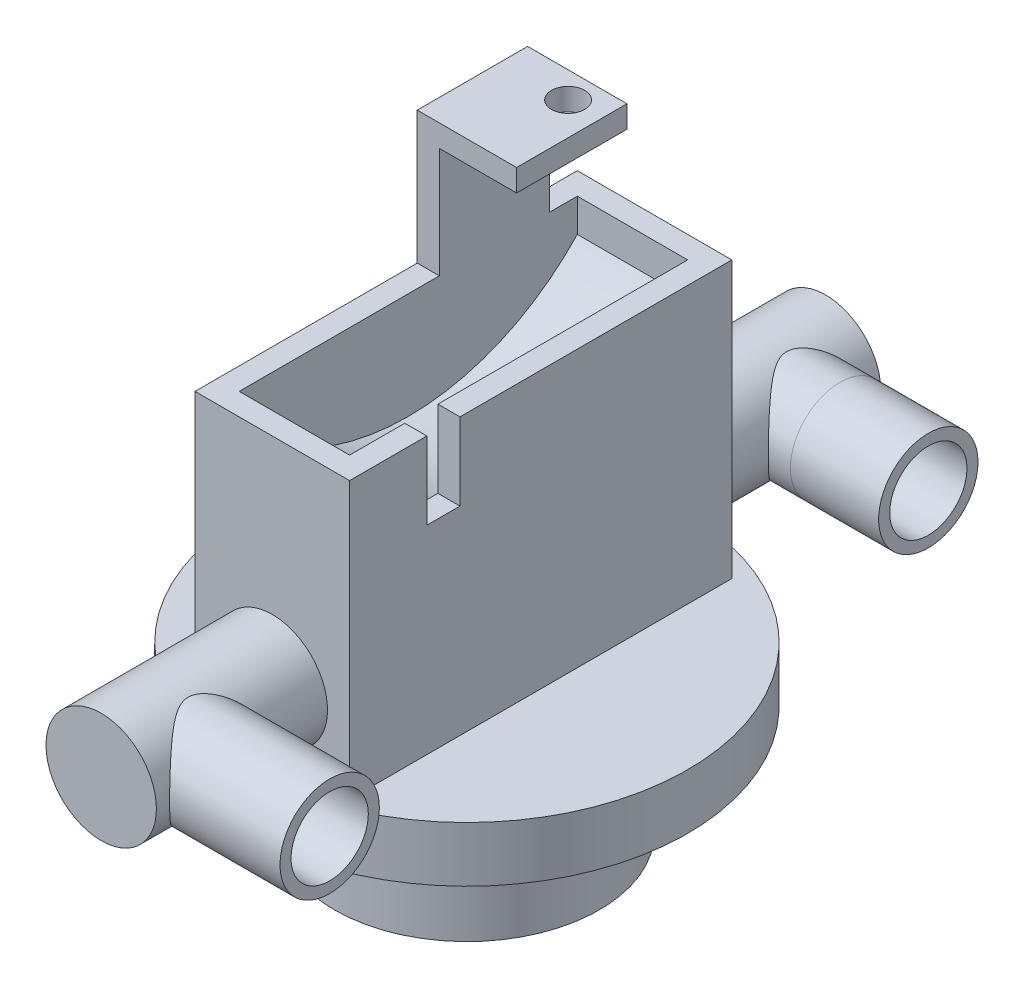
from build123d import *

# Parameters (mm, degrees)
SKETCH_1_R               = 20
EXTRUDE_1_DEPTH          = 5
SKETCH_2_W               = 14
SKETCH_2_H               = 34.630049735
EXTRUDE_2_DEPTH          = 25
SKETCH_3_W               = 10
SKETCH_3_H               = 30.630049735
CUT_EXTRUDE_1_DEPTH      = 3
CUT_EXTRUDE_2_DEPTH      = 10
SKETCH_5_W               = 2
SKETCH_5_H               = 3
CUT_EXTRUDE_3_DEPTH      = 7
SKETCH_6_W               = 2
SKETCH_6_H               = 10
EXTRUDE_3_DEPTH          = 10
EXTRUDE_4_DEPTH          = 2
SKETCH_8_R               = 1.5
CUT_EXTRUDE_4_DEPTH      = 2
SKETCH_9_R               = 4
CUT_EXTRUDE_5_DEPTH      = 35
EXTRUDE_START            = 14.5
SKETCH_10_R              = 5
SKETCH_10_R_2            = 4
EXTRUDE_5_DEPTH          = 14.5
EXTRUDE_6_REACH          = 61.375
EXTRUDE_6_END_RADIUS     = 5
SKETCH_11_R              = 4.5
CUT_EXTRUDE_6_REACH      = 61.375
CUT_EXTRUDE_6_END_RADIUS = 4
SKETCH_12_R              = 3.5
SKETCH_13_R              = 5
EXTRUDE_7_DEPTH          = 1
SKETCH_14_R              = 4.5
SKETCH_14_R_2            = 3.5
EXTRUDE_8_DEPTH          = 8
SKETCH_15_R              = 5
SKETCH_15_R_2            = 3.998003616
EXTRUDE_9_DEPTH          = 14.5
SKETCH_16_R              = 5
EXTRUDE_11_DEPTH         = 1
CUT_EXTRUDE_7_REACH      = 61.922
CUT_EXTRUDE_7_END_RADIUS = 5
SKETCH_17_R              = 3.5
SKETCH_19_R              = 12
EXTRUDE_12_DEPTH         = 10


with BuildPart() as part:
    # Эскиз1 → Бобышка-Вытянуть1 (new body)
    with BuildSketch(Plane(origin=(0, 0, 0), x_dir=(1, 0, 0), z_dir=(0, 1, 0))):
        with Locations(Location((0, 0, 0), (0, 0, 270))):
            Circle(SKETCH_1_R)
    extrude(amount=EXTRUDE_1_DEPTH)

    # Эскиз2 → Бобышка-Вытянуть2 (add)
    with BuildSketch(Plane(origin=(0, 5, 0), x_dir=(1, 0, 0), z_dir=(0, 1, 0))):
        with Locations((0, -0.315024868)):
            Rectangle(SKETCH_2_W, SKETCH_2_H)
    extrude(amount=EXTRUDE_2_DEPTH)

    # Эскиз3 → Вырез-Вытянуть1 (cut)
    with BuildSketch(Plane(origin=(0, 30, 0), x_dir=(1, 0, 0), z_dir=(0, 1, 0))):
        with Locations((0, -0.315024868)):
            Rectangle(SKETCH_3_W, SKETCH_3_H)
    extrude(amount=-CUT_EXTRUDE_1_DEPTH, mode=Mode.SUBTRACT)

    # Эскиз4 → Вырез-Вытянуть2 (cut)
    with BuildSketch(Plane(origin=(-5, 0, 0), x_dir=(0, 0, -1), z_dir=(1, 0, 0))):
        with BuildLine():
            Line((-15.630049735, 27), (15, 27))
            ThreePointArc((15, 27), (-0.315024867, 20.368368499), (-15.630049735, 27))
        make_face()
    extrude(amount=CUT_EXTRUDE_2_DEPTH, mode=Mode.SUBTRACT)

    # Эскиз5 → Вырез-Вытянуть3 (cut)
    with BuildSketch(Plane(origin=(0, 30, 0), x_dir=(1, 0, 0), z_dir=(0, 1, 0))):
        with Locations((6, -9.130049735)):
            Rectangle(SKETCH_5_W, SKETCH_5_H)
    extrude(amount=-CUT_EXTRUDE_3_DEPTH, mode=Mode.SUBTRACT)

    # Эскиз6 → Бобышка-Вытянуть3 (add)
    with BuildSketch(Plane(origin=(0, 30, 0), x_dir=(1, 0, 0), z_dir=(0, 1, 0))):
        with Locations((-6, 7.5)):
            Rectangle(SKETCH_6_W, SKETCH_6_H)
    extrude(amount=EXTRUDE_3_DEPTH)

    # Эскиз7 → Бобышка-Вытянуть4 (add)
    with BuildSketch(Plane(origin=(0, 40, 0), x_dir=(1, 0, 0), z_dir=(0, 1, 0))):
        Polygon((-7, 12.5), (-5, 12.5), (2, 12.5), (2, 2.5), (-5, 2.5), (-7, 2.5), align=None)
    extrude(amount=EXTRUDE_4_DEPTH)

    # Эскиз8 → Вырез-Вытянуть4 (cut)
    with BuildSketch(Plane(origin=(0, 42, 0), x_dir=(1, 0, 0), z_dir=(0, 1, 0))):
        with Locations(Location((-0.97037305, 10.13600386, 0), (0, 0, 270))):
            Circle(SKETCH_8_R)
    extrude(amount=-CUT_EXTRUDE_4_DEPTH, mode=Mode.SUBTRACT)

    # Эскиз9 → Вырез-Вытянуть5 (cut)
    with BuildSketch(Plane.XY.offset(17.630049735)):
        with Locations((0, 11)):
            Circle(SKETCH_9_R)
    extrude(amount=-CUT_EXTRUDE_5_DEPTH, mode=Mode.SUBTRACT)

    # Эскиз10 → Бобышка-Вытянуть5 (add)
    with BuildSketch(Plane.XY.offset(17.630049735).offset(EXTRUDE_START)):
        with Locations(Location((0, 11, 0), (0, 0, 180))):
            Circle(SKETCH_10_R)
        with Locations((0, 11)):
            Circle(SKETCH_10_R_2, mode=Mode.SUBTRACT)
    extrude(amount=-EXTRUDE_5_DEPTH)

    # Бобышка-Вытянуть6: up to this cylinder (the profile starts outside it)
    extrude_6_end = Plane(origin=(0, 11, 0.315025), z_dir=(0, 0, -1)) * Cylinder(EXTRUDE_6_END_RADIUS, 187.98005, mode=Mode.PRIVATE)
    # Эскиз11 → Бобышка-Вытянуть6 (add, up to the surface)
    with BuildSketch(Plane(origin=(7, 0, 0), x_dir=(0, 0, -1), z_dir=(1, 0, 0)), mode=Mode.PRIVATE) as extrude_6_sk1:
        with Locations((-27.430049735, 11)):
            Circle(SKETCH_11_R)
    extrude_6_tool1 = extrude(extrude_6_sk1.sketch, amount=-EXTRUDE_6_REACH, mode=Mode.PRIVATE) - extrude_6_end
    add(extrude_6_tool1.solids().sort_by_distance((7, 11, 27.43005))[0])
    # Эскиз11 → Бобышка-Вытянуть6 (add, up to the surface)
    with BuildSketch(Plane(origin=(7, 0, 0), x_dir=(0, 0, -1), z_dir=(1, 0, 0)), mode=Mode.PRIVATE) as extrude_6_sk2:
        with Locations((26.8, 11)):
            Circle(SKETCH_11_R)
    extrude_6_tool2 = extrude(extrude_6_sk2.sketch, amount=-EXTRUDE_6_REACH, mode=Mode.PRIVATE) - extrude_6_end
    add(extrude_6_tool2.solids().sort_by_distance((7, 11, -26.8))[0])


with BuildPart() as extrude_6_piece_1:
    # of the separate pieces the step leaves, piece 1, a body of its own (extrude_6_pieces)
    add(part.part.solids().sort_by_distance((0, 0, 20))[0])

    # Вырез-Вытянуть6: up to this cylinder (the profile starts outside it)
    cut_extrude_6_end = Plane(origin=(0, 11, 27.43005), z_dir=(0, 0, 1)) * Cylinder(CUT_EXTRUDE_6_END_RADIUS, 131.75, mode=Mode.PRIVATE)
    # Эскиз12 → Вырез-Вытянуть6 (cut, up to the surface)
    with BuildSketch(Plane(origin=(7, 0, 0), x_dir=(0, 0, -1), z_dir=(1, 0, 0)), mode=Mode.PRIVATE) as cut_extrude_6_sk1:
        with Locations((-27.430049735, 11)):
            Circle(SKETCH_12_R)
    cut_extrude_6_tool1 = extrude(cut_extrude_6_sk1.sketch, amount=-CUT_EXTRUDE_6_REACH, mode=Mode.PRIVATE) - cut_extrude_6_end
    add(cut_extrude_6_tool1.solids().sort_by_distance((7, 11, 27.43005))[0], mode=Mode.SUBTRACT)

    # Эскиз13 → Бобышка-Вытянуть7 (add)
    with BuildSketch(Plane.XY.offset(32.130049735)):
        with Locations(Location((0, 11, 0), (0, 0, 180))):
            Circle(SKETCH_13_R)
    extrude(amount=EXTRUDE_7_DEPTH)

    # Эскиз14 → Бобышка-Вытянуть8 (add)
    # profile 1 of 2: a face of its own
    with BuildSketch(Plane(origin=(7, 0, 0), x_dir=(0, 0, -1), z_dir=(1, 0, 0))):
        with Locations((-27.430049735, 11)):
            Circle(SKETCH_14_R)
        with Locations((-27.430049735, 11)):
            Circle(SKETCH_14_R_2, mode=Mode.SUBTRACT)
    # profile 2 of 2: a face of its own
    with BuildSketch(Plane(origin=(7, 0, 0), x_dir=(0, 0, -1), z_dir=(1, 0, 0))):
        with Locations((26.8, 11)):
            Circle(SKETCH_14_R)
        with Locations((26.8, 11)):
            Circle(SKETCH_14_R_2, mode=Mode.SUBTRACT)
    extrude(amount=EXTRUDE_8_DEPTH)


with BuildPart() as extrude_6_piece_2:
    # of the separate pieces the step leaves, piece 2, a body of its own (extrude_6_pieces)
    add(part.part.solids().sort_by_distance((5, 11, -31.3))[0])

    # Вырез-Вытянуть7: up to this cylinder (the profile starts outside it)
    cut_extrude_7_end = Plane(origin=(0, 11, -26.8), z_dir=(0, 0, -1)) * Cylinder(CUT_EXTRUDE_7_END_RADIUS, 134.844, mode=Mode.PRIVATE)
    # Эскиз17 → Вырез-Вытянуть7 (cut, up to the surface)
    with BuildSketch(Plane(origin=(7, 0, 0), x_dir=(0, 0, -1), z_dir=(1, 0, 0)), mode=Mode.PRIVATE) as cut_extrude_7_sk1:
        with Locations((26.8, 11)):
            Circle(SKETCH_17_R)
    cut_extrude_7_tool1 = extrude(cut_extrude_7_sk1.sketch, amount=-CUT_EXTRUDE_7_REACH, mode=Mode.PRIVATE) - cut_extrude_7_end
    add(cut_extrude_7_tool1.solids().sort_by_distance((7, 11, -26.8))[0], mode=Mode.SUBTRACT)


with BuildPart() as extrude_8_piece_1:
    # of the separate pieces the step leaves, piece 1, a body of its own (extrude_8_pieces)
    add(extrude_6_piece_1.part.solids().sort_by_distance((0, 0, 20))[0])

    # Эскиз15 → Бобышка-Вытянуть9 (add)
    with BuildSketch(Plane(origin=(0, 0, -17), x_dir=(-1, 0, 0), z_dir=(0, 0, -1))):
        with Locations((0, 11)):
            Circle(SKETCH_15_R)
        with Locations(Location((0, 11, 0), (0, 0, 180))):
            Circle(SKETCH_15_R_2, mode=Mode.SUBTRACT)
    extrude(amount=EXTRUDE_9_DEPTH)

    # Эскиз16 → Бобышка-Вытянуть11 (add)
    with BuildSketch(Plane(origin=(0, 0, -31.5), x_dir=(-1, 0, 0), z_dir=(0, 0, -1))):
        with Locations((0, 11)):
            Circle(SKETCH_16_R)
    extrude(amount=EXTRUDE_11_DEPTH)

    # Эскиз19 → Бобышка-Вытянуть12 (add)
    with BuildSketch(Plane.XZ):
        with Locations(Location((0, 0, 0), (0, 0, 90))):
            Circle(SKETCH_19_R)
    extrude(amount=EXTRUDE_12_DEPTH)


with BuildPart() as extrude_8_piece_2:
    # of the separate pieces the step leaves, piece 2, a body of its own (extrude_8_pieces)
    add(extrude_6_piece_1.part.solids().sort_by_distance((7, 11, -31.3))[0])


solid = Compound([extrude_6_piece_2.part, extrude_8_piece_1.part, extrude_8_piece_2.part])
